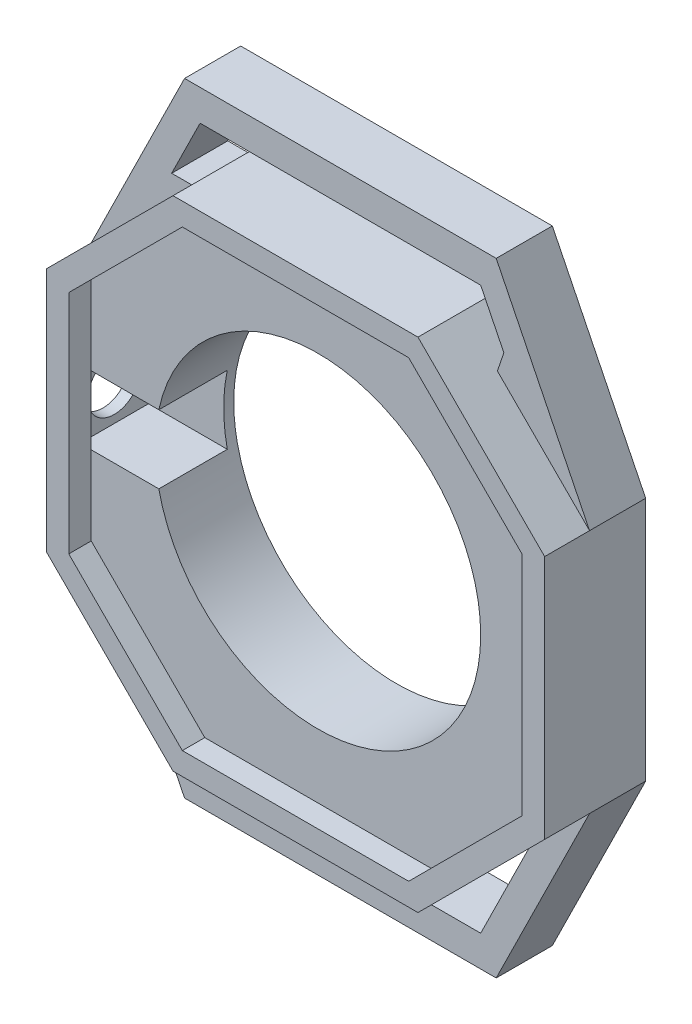
from build123d import *
from OCP.BRepFilletAPI import BRepFilletAPI_MakeChamfer

# Parameters (mm, degrees)
SKETCH1_R               = 14.5
BOSS_EXTRUDE1_DEPTH     = 7
BOSS_EXTRUDE2_DEPTH     = 2
BOSS_EXTRUDE3_DEPTH     = 5
CHAMFER1_SIZE           = 5
CHAMFER1_SIZE2          = 3.942733198
CUT_EXTRUDE1_REACH      = 134.354
CUT_EXTRUDE1_END_RADIUS = 14.5
CUT_EXTRUDE1_START      = -1
SKETCH3_W               = 6.1
SKETCH3_H               = 6.1
SKETCH3_3_R             = 2.35
CUT_EXTRUDE2_DEPTH      = 5


with BuildPart() as part:
    # Sketch1 → Boss-Extrude1 (new body)
    with BuildSketch(Plane(origin=(0, 0, 0), x_dir=(-1, 0, 0), z_dir=(0, 0, -1))):
        Polygon((-144.048730163, -117.859999), (-132.76, -106.571268837), (-132.76, -84.748729163), (-144.048730163, -73.459999), (-165.871269837, -73.459999), (-177.16, -84.748729163), (-177.16, -106.571268837), (-165.871269837, -117.859999), align=None)
        with Locations((-154.96, -95.659999)):
            Circle(SKETCH1_R, mode=Mode.SUBTRACT)
    extrude(amount=BOSS_EXTRUDE1_DEPTH)

    # Sketch1<3> → Boss-Extrude2 (add)
    with BuildSketch(Plane(origin=(0, 0, 0), x_dir=(-1, 0, 0), z_dir=(0, 0, -1))):
        Polygon((-144.048730163, -117.859999), (-132.76, -106.571268837), (-132.76, -84.748729163), (-144.048730163, -73.459999), (-165.871269837, -73.459999), (-177.16, -84.748729163), (-177.16, -106.571268837), (-165.871269837, -117.859999), align=None)
        Polygon((-165.042842712, -75.459999), (-144.877157288, -75.459999), (-134.76, -85.577156288), (-134.76, -105.742841712), (-144.877157288, -115.859999), (-165.042842712, -115.859999), (-175.16, -105.742841712), (-175.16, -85.577156288), align=None, mode=Mode.SUBTRACT)
    extrude(amount=-BOSS_EXTRUDE2_DEPTH)

    # Sketch2 → Boss-Extrude3 (add)
    with BuildSketch(Plane.XY.offset(-7)):
        Polygon((141.07800326, -73.459999), (142.46, -70.659999), (167.46, -70.659999), (168.84199674, -73.459999), (171.737289726, -79.326018889), (177.16, -84.748729163), (168.84199674, -67.896005521), (141.07800326, -67.896005521), (132.76, -84.748729163), (138.182710274, -79.326018889), align=None)
    boss_extrude3 = extrude(amount=BOSS_EXTRUDE3_DEPTH)

    # Chamfer1: one chamfer whose edges measure the first distance from different faces: ONE call of the kernel's chamfer builder (chamfer() names one face for all edges)
    chamfer1_edges_1 = [part.edges().sort_by_distance(p)[0] for p in [
        (171.737289726, -79.326018889, -4.5),
    ]]
    chamfer1_side_1 = [part.faces().sort_by_distance(p)[0] for p in [
        (169.598644863, -74.993008944, -4.5),
    ]]
    chamfer1_edges_2 = [part.edges().sort_by_distance(p)[0] for p in [
        (138.182710274, -79.326018889, -4.5),
    ]]
    chamfer1_side_2 = [part.faces().sort_by_distance(p)[0] for p in [
        (139.472020238, -78.036708925, -1.77197304),
    ]]
    chamfer1 = BRepFilletAPI_MakeChamfer(part.part.solid().wrapped)
    for e in chamfer1_edges_1:
        chamfer1.Add(CHAMFER1_SIZE, CHAMFER1_SIZE2, e.wrapped, chamfer1_side_1[0].wrapped)  # the first distance lies on this face
    for e in chamfer1_edges_2:
        chamfer1.Add(CHAMFER1_SIZE, CHAMFER1_SIZE2, e.wrapped, chamfer1_side_2[0].wrapped)  # the first distance lies on this face
    add(Compound.cast(chamfer1.Shape()), mode=Mode.REPLACE)

    # Mirror1: Boss-Extrude3 across plane
    add(boss_extrude3.mirror(Plane(origin=(0, -95.659999, 0), x_dir=(0, 0, 1), z_dir=(0, -1, 0))))

    # Cut-Extrude1: up to this cylinder (the profile starts outside it)
    cut_extrude1_end = Plane(origin=(154.96, -95.659999, -3.05), z_dir=(0, 0, 1)) * Cylinder(CUT_EXTRUDE1_END_RADIUS, 298.708, mode=Mode.PRIVATE)
    # Sketch3 → Cut-Extrude1 (cut, up to the surface)
    with BuildSketch(Plane.ZY.offset(-132.76).offset(CUT_EXTRUDE1_START), mode=Mode.PRIVATE) as cut_extrude1_sk1:
        with Locations((-3.05, -95.659999)):
            Rectangle(SKETCH3_W, SKETCH3_H)
    cut_extrude1_tool1 = extrude(cut_extrude1_sk1.sketch, amount=-CUT_EXTRUDE1_REACH, mode=Mode.PRIVATE) - cut_extrude1_end
    add(cut_extrude1_tool1.solids().sort_by_distance((133.76, -95.659999, -3.05))[0], mode=Mode.SUBTRACT)

    # Sketch3<3> → Cut-Extrude2 (cut)
    with BuildSketch(Plane.ZY.offset(-132.76)):
        with Locations((-3.05, -95.659999)):
            Circle(SKETCH3_3_R)
    extrude(amount=-CUT_EXTRUDE2_DEPTH, mode=Mode.SUBTRACT)


solid = part.part
